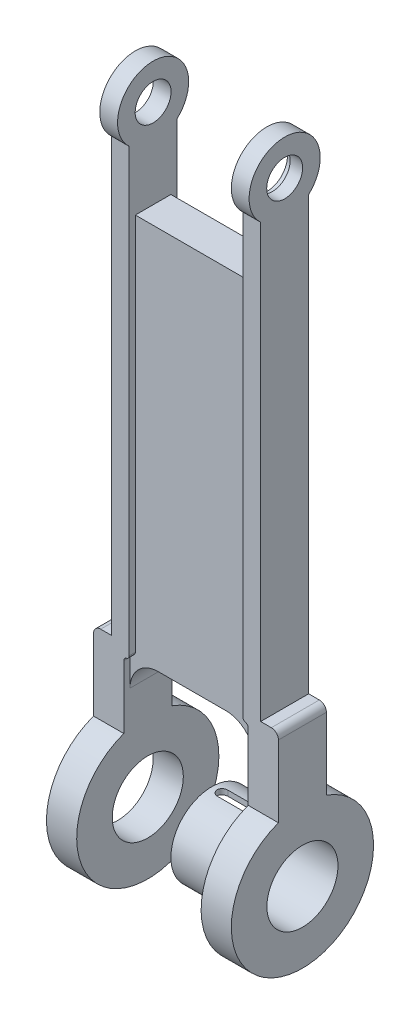
from build123d import *
from build123d.topology import SkipClean

# Parameters (mm, degrees)
SALIENTE_EXTRUIR1_DEPTH    = 10
SALIENTE_EXTRUIR2_DEPTH    = 10
SALIENTE_EXTRUIR3_DEPTH    = 10
SALIENTE_EXTRUIR4_DEPTH    = 1.75
SALIENTE_EXTRUIR5_START    = 1.75
SALIENTE_EXTRUIR5_DEPTH    = 1.75
CROQUIS26_W                = 5
CROQUIS26_H                = 35
SALIENTE_EXTRUIR6_DEPTH    = 1.75
CROQUIS27_W                = 5
CROQUIS27_H                = 35
SALIENTE_EXTRUIR7_DEPTH    = 11.75
CORTAR_EXTRUIR3_DEPTH      = 205.699932829
CORTAR_EXTRUIR3_DEPTH_BACK = 99.75
SALIENTE_EXTRUIR8_START    = -5
SALIENTE_EXTRUIR8_DEPTH    = 5
CROQUIS29_R                = 10
SALIENTE_EXTRUIR9_DEPTH    = 5
CORTAR_EXTRUIR5_DEPTH      = 206.22487666
CORTAR_EXTRUIR5_DEPTH_BACK = 206.22487666
SALIENTE_EXTRUIR11_START   = -8.5
CROQUIS32_R                = 20
SALIENTE_EXTRUIR11_DEPTH   = 8.5
CROQUIS33_R                = 20
SALIENTE_EXTRUIR12_DEPTH   = 8.5
CROQUIS34_R                = 5.05
CORTAR_EXTRUIR6_DEPTH      = 90
CROQUIS39_R                = 5.78
CORTAR_EXTRUIR7_DEPTH      = 1.5
CROQUIS41_R                = 10
CORTAR_EXTRUIR8_DEPTH      = 43
CROQUIS42_R                = 4
CORTAR_EXTRUIR9_DEPTH      = 27
CROQUIS43_R                = 10
CORTAR_EXTRUIR10_DEPTH     = 12
CROQUIS45_R                = 11.5
SALIENTE_EXTRUIR13_DEPTH   = 17
REDONDEO1_R                = 2
SALIENTE_EXTRUIR14_START   = -6
SALIENTE_EXTRUIR14_DEPTH   = 6
CROQUIS48_R                = 10
CORTAR_EXTRUIR12_DEPTH     = 17
SALIENTE_EXTRUIR16_DEPTH   = 6
CORTAR_EXTRUIR20_DEPTH     = 6
CORTAR_EXTRUIR21_DEPTH     = 10
CORTAR_EXTRUIR22_START     = -13
CORTAR_EXTRUIR22_DEPTH     = 13
CORTAR_EXTRUIR23_START     = -13
CORTAR_EXTRUIR23_DEPTH     = 13


with BuildPart() as part:
    # Croquis1 → Saliente-Extruir1 (new body)
    with BuildSketch(Plane.XY):
        Polygon((0, -143), (0, -35), (-1.6, -35), (-37.4, -35), (-42, -35), (-42, -143), align=None)
    extrude(amount=-SALIENTE_EXTRUIR1_DEPTH)

    # Croquis3 → Saliente-Extruir2 (add)
    with BuildSketch(Plane.XY):
        with BuildLine():
            Line((-47, -141), (-47, -145))
            Line((-47, -145), (-47, -160))
            Line((-47, -160), (-47, -180))
            Line((-47, -180), (-47, -200))
            Line((-47, -200), (-38.5, -200))
            Line((-38.5, -200), (-38.5, -151))
            Line((-38.5, -151), (-38.5, -143))
            Line((-38.5, -143), (-42, -143))
            Line((-42, -143), (-42, -139))
            Line((-42, -139), (-45, -139))
            ThreePointArc((-45, -139), (-46.414213562, -139.585786438), (-47, -141))
        make_face()
        with BuildLine():
            Line((0, -143), (-11.5, -143))
            ThreePointArc((-11.5, -143), (-5.843145751, -145.343145751), (-3.5, -151))
            Line((-3.5, -151), (-3.5, -200))
            Line((-3.5, -200), (5, -200))
            Line((5, -200), (5, -143))
            Line((5, -143), (5, -141))
            ThreePointArc((5, -141), (4.414213562, -139.585786438), (3, -139))
            Line((3, -139), (0, -139))
            Line((0, -139), (0, -143))
        make_face()
    extrude(amount=-SALIENTE_EXTRUIR2_DEPTH)

    # Croquis21 → Saliente-Extruir3 (add)
    with BuildSketch(Plane.XY):
        with BuildLine():
            Line((-38.5, -143), (-38.5, -151))
            ThreePointArc((-38.5, -151), (-36.156854249, -145.343145751), (-30.5, -143))
            Line((-30.5, -143), (-38.5, -143))
        make_face()
    extrude(amount=-SALIENTE_EXTRUIR3_DEPTH)

    # Croquis22 → Saliente-Extruir4 (add)
    with BuildSketch(Plane(origin=(0, 0, -10), x_dir=(-1, 0, 0), z_dir=(0, 0, -1))):
        with BuildLine():
            Line((3.5, -200), (3.5, -156.87358131))
            Line((3.5, -156.87358131), (3.5, -151))
            Line((3.5, -151), (3.5, -141.333778868))
            ThreePointArc((3.5, -141.333778868), (3.709430585, -140.721406432), (4.25, -140.365533031))
            ThreePointArc((4.25, -140.365533031), (4.790569415, -140.00965963), (5, -139.397287194))
            Line((5, -139.397287194), (5, -35))
            Line((5, -35), (0, -35))
            Line((0, -35), (0, -139))
            Line((0, -139), (-3, -139))
            ThreePointArc((-3, -139), (-4.414213562, -139.585786438), (-5, -141))
            Line((-5, -141), (-5, -200))
            Line((-5, -200), (3.5, -200))
        make_face()
        with BuildLine():
            Line((42, -35), (37, -35))
            Line((37, -35), (37, -139.397287194))
            ThreePointArc((37, -139.397287194), (37.209430585, -140.00965963), (37.75, -140.365533031))
            ThreePointArc((37.75, -140.365533031), (38.290569415, -140.721406432), (38.5, -141.333778868))
            Line((38.5, -141.333778868), (38.5, -151))
            Line((38.5, -151), (38.5, -155.512462497))
            Line((38.5, -155.512462497), (38.5, -200))
            Line((38.5, -200), (47, -200))
            Line((47, -200), (47, -141))
            ThreePointArc((47, -141), (46.414213562, -139.585786438), (45, -139))
            Line((45, -139), (42, -139))
            Line((42, -139), (42, -35))
        make_face()
    extrude(amount=SALIENTE_EXTRUIR4_DEPTH)

    # Croquis24 → Saliente-Extruir5 (add)
    with BuildSketch(Plane.XY.offset(SALIENTE_EXTRUIR5_START)):
        with BuildLine():
            Line((-37, -141.498649254), (-37, -35))
            Line((-37, -35), (-42, -35))
            Line((-42, -35), (-42, -139))
            Line((-42, -139), (-45, -139))
            ThreePointArc((-45, -139), (-46.414213562, -139.585786438), (-47, -141))
            Line((-47, -141), (-47, -200))
            Line((-47, -200), (-38.5, -200))
            Line((-38.5, -200), (-38.5, -143.435140927))
            ThreePointArc((-38.5, -143.435140927), (-38.290569415, -142.822768491), (-37.75, -142.466895091))
            ThreePointArc((-37.75, -142.466895091), (-37.209430585, -142.11102169), (-37, -141.498649254))
        make_face()
        with BuildLine():
            Line((0, -35), (-5, -35))
            Line((-5, -35), (-5, -140.397287194))
            ThreePointArc((-5, -140.397287194), (-4.790569415, -141.00965963), (-4.25, -141.365533031))
            ThreePointArc((-4.25, -141.365533031), (-3.709430585, -141.721406432), (-3.5, -142.333778868))
            Line((-3.5, -142.333778868), (-3.5, -200))
            Line((-3.5, -200), (5, -200))
            Line((5, -200), (5, -141))
            ThreePointArc((5, -141), (4.414213562, -139.585786438), (3, -139))
            Line((3, -139), (0, -139))
            Line((0, -139), (0, -35))
        make_face()
    extrude(amount=-SALIENTE_EXTRUIR5_DEPTH)

    # Croquis26 → Saliente-Extruir6 (add)
    with BuildSketch(Plane.XY):
        with Locations((-39.5, -17.5)):
            Rectangle(CROQUIS26_W, CROQUIS26_H)
        with Locations((-2.5, -17.5)):
            Rectangle(CROQUIS26_W, CROQUIS26_H)
    extrude(amount=SALIENTE_EXTRUIR6_DEPTH)

    # Croquis27 → Saliente-Extruir7 (add)
    with BuildSketch(Plane(origin=(0, 0, 0), x_dir=(-1, 0, 0), z_dir=(0, 0, -1))):
        with Locations((2.5, -17.5)):
            Rectangle(CROQUIS27_W, CROQUIS27_H)
        with Locations((39.5, -17.5)):
            Rectangle(CROQUIS27_W, CROQUIS27_H)
    extrude(amount=SALIENTE_EXTRUIR7_DEPTH)

    # Croquis28 → Cortar-Extruir3 (cut, two sides: drawn at the far end of the back side and taken through both)
    with BuildSketch(Plane.ZY.offset(5).offset(-CORTAR_EXTRUIR3_DEPTH_BACK)):
        with BuildLine():
            ThreePointArc((-11.75, -2.621822718), (-8.62065099, -0.678471884), (-5, 0))
            Line((-5, 0), (-11.75, 0))
            Line((-11.75, 0), (-11.75, -2.621822718))
        make_face()
        with BuildLine():
            Line((1.75, -2.621822718), (1.75, 0))
            Line((1.75, 0), (-5, 0))
            ThreePointArc((-5, 0), (-1.37934901, -0.678471884), (1.75, -2.621822718))
        make_face()
    extrude(amount=CORTAR_EXTRUIR3_DEPTH + CORTAR_EXTRUIR3_DEPTH_BACK, mode=Mode.SUBTRACT)

    # Croquis28<5> → Saliente-Extruir8 (add)
    with BuildSketch(Plane.ZY.offset(5).offset(SALIENTE_EXTRUIR8_START)):
        with BuildLine():
            Line((-11.75, -17.378177282), (-11.75, -2.621822718))
            ThreePointArc((-11.75, -2.621822718), (-15, -10), (-11.75, -17.378177282))
        make_face()
        with BuildLine():
            ThreePointArc((5, -10), (4.151502609, -5.968871126), (1.75, -2.621822718))
            Line((1.75, -2.621822718), (1.75, -17.378177282))
            ThreePointArc((1.75, -17.378177282), (4.151502609, -14.031128874), (5, -10))
        make_face()
    extrude(amount=SALIENTE_EXTRUIR8_DEPTH)

    # Croquis29 → Saliente-Extruir9 (add)
    with BuildSketch(Plane(origin=(-37, 0, 0), x_dir=(0, 0, -1), z_dir=(1, 0, 0))):
        with Locations((5, -10)):
            Circle(CROQUIS29_R)
    extrude(amount=-SALIENTE_EXTRUIR9_DEPTH)

    # Croquis31 → Cortar-Extruir5 (cut, two sides: drawn at the far end of the back side and taken through both)
    with BuildSketch(Plane(origin=(-38.5, 0, 0), x_dir=(0, 0, -1), z_dir=(1, 0, 0)).offset(-CORTAR_EXTRUIR5_DEPTH_BACK)):
        with BuildLine():
            Line((-1.75, -200), (5, -200))
            ThreePointArc((5, -200), (1.574376792, -199.704443804), (-1.75, -198.826510564))
            Line((-1.75, -198.826510564), (-1.75, -200))
        make_face()
        with BuildLine():
            Line((11.75, -200), (11.75, -198.826510564))
            ThreePointArc((11.75, -198.826510564), (8.425623208, -199.704443804), (5, -200))
            Line((5, -200), (11.75, -200))
        make_face()
    extrude(amount=CORTAR_EXTRUIR5_DEPTH + CORTAR_EXTRUIR5_DEPTH_BACK, mode=Mode.SUBTRACT)

    # Croquis32 → Saliente-Extruir11 (add)
    with BuildSketch(Plane(origin=(-38.5, 0, 0), x_dir=(0, 0, -1), z_dir=(1, 0, 0)).offset(SALIENTE_EXTRUIR11_START)):
        with Locations((5, -180)):
            Circle(CROQUIS32_R)
    extrude(amount=SALIENTE_EXTRUIR11_DEPTH)

    # Croquis33 → Saliente-Extruir12 (add)
    with BuildSketch(Plane.ZY.offset(3.5)):
        with Locations((-5, -180)):
            Circle(CROQUIS33_R)
    extrude(amount=-SALIENTE_EXTRUIR12_DEPTH)

    # Croquis34 → Cortar-Extruir6 (cut)
    with BuildSketch(Plane.ZY.offset(42)):
        with Locations(Location((-5, -10, 0), (0, 0, 270))):
            Circle(CROQUIS34_R)
    extrude(amount=-CORTAR_EXTRUIR6_DEPTH, mode=Mode.SUBTRACT)

    # Croquis39 → Cortar-Extruir7 (cut)
    with SkipClean():  # the faces are left unmerged after this step: merging them gives an invalid solid
        with BuildSketch(Plane.ZY.offset(5)):
            with Locations(Location((-5, -10, 0), (0, 0, 270))):
                Circle(CROQUIS39_R)
        extrude(amount=-CORTAR_EXTRUIR7_DEPTH, mode=Mode.SUBTRACT)

    # Croquis41 → Cortar-Extruir8 (cut)
    with SkipClean():  # the faces are left unmerged after this step: merging them gives an invalid solid
        with BuildSketch(Plane(origin=(-38.5, 0, 0), x_dir=(0, 0, -1), z_dir=(1, 0, 0))):
            with Locations((5, -180)):
                Circle(CROQUIS41_R)
        extrude(amount=-CORTAR_EXTRUIR8_DEPTH, mode=Mode.SUBTRACT)

    # Croquis42 → Cortar-Extruir9 (cut)
    with SkipClean():  # the faces are left unmerged after this step: merging them gives an invalid solid
        with BuildSketch(Plane(origin=(5, 0, 0), x_dir=(0, 0, -1), z_dir=(1, 0, 0))):
            with Locations(Location((5, -180, 0), (0, 0, 90))):
                Circle(CROQUIS42_R)
        extrude(amount=-CORTAR_EXTRUIR9_DEPTH, mode=Mode.SUBTRACT)

    # Croquis43 → Cortar-Extruir10 (cut)
    with SkipClean():  # the faces are left unmerged after this step: merging them gives an invalid solid
        with BuildSketch(Plane(origin=(5, 0, 0), x_dir=(0, 0, -1), z_dir=(1, 0, 0))):
            with Locations((5, -180)):
                Circle(CROQUIS43_R)
        extrude(amount=-CORTAR_EXTRUIR10_DEPTH, mode=Mode.SUBTRACT)

    # Croquis45 → Saliente-Extruir13 (add)
    with SkipClean():  # the faces are left unmerged after this step: merging them gives an invalid solid
        with BuildSketch(Plane.ZY.offset(3.5)):
            with Locations(Location((-5, -180, 0), (0, 0, 270))):
                Circle(CROQUIS45_R)
        extrude(amount=SALIENTE_EXTRUIR13_DEPTH)

    # Redondeo1
    redondeo1_edges = [part.edges().sort_by_distance(p)[0] for p in [
        (-3.5, -168.5, -5),
    ]]
    fillet(redondeo1_edges, radius=REDONDEO1_R)

    # Croquis46 → Saliente-Extruir14 (add)
    with SkipClean():  # the faces are left unmerged after this step: merging them gives an invalid solid
        with BuildSketch(Plane.ZY.offset(20.5).offset(SALIENTE_EXTRUIR14_START)):
            with BuildLine():
                ThreePointArc((-8, -168.898198344), (-6.513155802, -168.599984232), (-5, -168.5))
                Line((-5, -168.5), (-8, -168.5))
                Line((-8, -168.5), (-8, -168.898198344))
            make_face()
            with BuildLine():
                Line((-2, -168.5), (-5, -168.5))
                ThreePointArc((-5, -168.5), (-3.486844198, -168.599984232), (-2, -168.898198344))
                Line((-2, -168.898198344), (-2, -168.5))
            make_face()
            Polygon((-2, -167.763778716), (-2, -168.5), (-5, -168.5), (-8, -168.5), (-8, -167.763778716), align=None)
        extrude(amount=SALIENTE_EXTRUIR14_DEPTH)

    # Croquis48 → Cortar-Extruir12 (cut)
    with SkipClean():  # the faces are left unmerged after this step: merging them gives an invalid solid
        with BuildSketch(Plane(origin=(-3.5, 0, 0), x_dir=(0, 0, -1), z_dir=(1, 0, 0))):
            with Locations((5, -180)):
                Circle(CROQUIS48_R)
        extrude(amount=-CORTAR_EXTRUIR12_DEPTH, mode=Mode.SUBTRACT)


with BuildPart() as body_2:
    # Croquis50 → Saliente-Extruir16 (new body)
    with BuildSketch(Plane.ZY.offset(20.5)):
        with BuildLine():
            ThreePointArc((-16.101801656, -183), (-16.400015768, -181.513155802), (-16.5, -180))
            Line((-16.5, -180), (-16.5, -183))
            Line((-16.5, -183), (-16.101801656, -183))
        make_face()
        with BuildLine():
            Line((-16.5, -176.344003647), (-16.5, -180))
            ThreePointArc((-16.5, -180), (-16.349864922, -178.147821214), (-15.903379782, -176.344003647))
            Line((-15.903379782, -176.344003647), (-16.5, -176.344003647))
        make_face()
        Polygon((-17.164048231, -176.344003647), (-17.164048231, -183), (-16.5, -183), (-16.5, -180), (-16.5, -176.344003647), align=None)
    extrude(amount=-SALIENTE_EXTRUIR16_DEPTH)


with BuildPart() as cortar_extruir20_tool:
    # Croquis51 → Cortar-Extruir20 (new body)
    with SkipClean():  # the faces are left unmerged after this step: merging them gives an invalid solid
        with BuildSketch(Plane(origin=(0, 0, -17.164048231), x_dir=(-1, 0, 0), z_dir=(0, 0, -1))):
            with BuildLine():
                Line((17.5, -181.699099172), (8.5, -181.699099172))
                ThreePointArc((8.5, -181.699099172), (7, -180.199099172), (8.5, -178.699099172))
                Line((8.5, -178.699099172), (17.5, -178.699099172))
                ThreePointArc((17.5, -178.699099172), (19, -180.199099172), (17.5, -181.699099172))
            make_face()
        extrude(amount=-CORTAR_EXTRUIR20_DEPTH)


with BuildPart() as part_1:
    with SkipClean():  # the faces are left unmerged after this step: merging them gives an invalid solid
        add(part.part)

        # Cortar-Extruir20: cut by cortar_extruir20_tool
        add(cortar_extruir20_tool.part, mode=Mode.SUBTRACT)

    # Croquis53 → Cortar-Extruir21 (cut)
    with SkipClean():  # the faces are left unmerged after this step: merging them gives an invalid solid
        with BuildSketch(Plane(origin=(0, -167.763778716, 0), x_dir=(1, 0, 0), z_dir=(0, 1, 0))):
            with BuildLine():
                Line((-8.499402012, 3.542350975), (-17.5, 3.542350975))
                ThreePointArc((-17.5, 3.542350975), (-19, 5.042350975), (-17.5, 6.542350975))
                Line((-17.5, 6.542350975), (-8.499402012, 6.542350975))
                ThreePointArc((-8.499402012, 6.542350975), (-6.999402012, 5.042350975), (-8.499402012, 3.542350975))
            make_face()
        extrude(amount=-CORTAR_EXTRUIR21_DEPTH, mode=Mode.SUBTRACT)

    # Croquis49 → Cortar-Extruir22 (cut)
    with SkipClean():  # the faces are left unmerged after this step: merging them gives an invalid solid
        with BuildSketch(Plane.ZY.offset(20.5).offset(CORTAR_EXTRUIR22_START)):
            with BuildLine():
                Line((-2, -167.763778716), (-8, -167.763778716))
                Line((-8, -167.763778716), (-8, -168.898198344))
                ThreePointArc((-8, -168.898198344), (-5, -168.5), (-2, -168.898198344))
                Line((-2, -168.898198344), (-2, -167.763778716))
            make_face()
        extrude(amount=CORTAR_EXTRUIR22_DEPTH, mode=Mode.SUBTRACT)


with BuildPart() as body_2_1:
    with SkipClean():  # the faces are left unmerged after this step: merging them gives an invalid solid
        add(body_2.part)

        # Cortar-Extruir20: cut by cortar_extruir20_tool
        add(cortar_extruir20_tool.part, mode=Mode.SUBTRACT)

    # Croquis52 → Cortar-Extruir23 (cut)
    with BuildSketch(Plane.ZY.offset(20.5).offset(CORTAR_EXTRUIR23_START)):
        with BuildLine():
            Line((-17.164048231, -183), (-16.101801656, -183))
            ThreePointArc((-16.101801656, -183), (-16.494893405, -179.657325791), (-15.903379782, -176.344003647))
            Line((-15.903379782, -176.344003647), (-17.164048231, -176.344003647))
            Line((-17.164048231, -176.344003647), (-17.164048231, -183))
        make_face()
    extrude(amount=CORTAR_EXTRUIR23_DEPTH, mode=Mode.SUBTRACT)


solid = part_1.part
